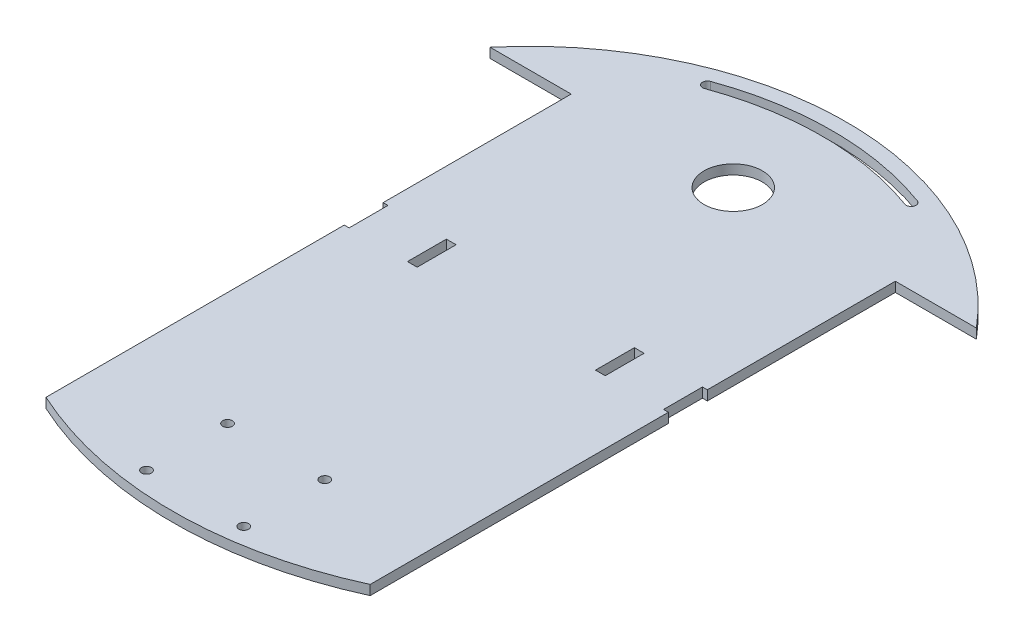
from build123d import *

# Parameters (mm, degrees)
SKETCH1_R           = 9
SKETCH1_W           = 3
SKETCH1_H           = 12
BOSS_EXTRUDE1_DEPTH = 3
SKETCH2_R           = 1.5
CUT_EXTRUDE1_DEPTH  = 139.166566144


with BuildPart() as part:
    # Sketch1 → Boss-Extrude1 (new body)
    with BuildSketch(Plane(origin=(0, 0, 0), x_dir=(1, 0, 0), z_dir=(0, 1, 0))):
        with BuildLine():
            Line((50, -81), (50, 11))
            Line((50, 11), (48.5, 11))
            Line((48.5, 11), (48.5, 23))
            Line((48.5, 23), (50, 23))
            Line((50, 23), (50, 81))
            Line((50, 81), (75, 81))
            ThreePointArc((75, 81), (0, 116), (-75, 81))
            Line((-75, 81), (-50, 81))
            Line((-50, 81), (-50, 23))
            Line((-50, 23), (-48.5, 23))
            Line((-48.5, 23), (-48.5, 11))
            Line((-48.5, 11), (-50, 11))
            Line((-50, 11), (-50, -81))
            ThreePointArc((-50, -81), (0, -91.912878854), (50, -81))
        make_face()
        with Locations(Location((0, 81, 0), (0, 0, 270))):
            Circle(SKETCH1_R, mode=Mode.SUBTRACT)
        with Locations((-29, 17)):
            Rectangle(SKETCH1_W, SKETCH1_H, mode=Mode.SUBTRACT)
        with Locations((29, 17)):
            Rectangle(SKETCH1_W, SKETCH1_H, mode=Mode.SUBTRACT)
        with BuildLine():
            ThreePointArc((31.93002338, 105.869875383), (0, 111.5), (-31.93002338, 105.869875383))
            ThreePointArc((-31.93002338, 105.869875383), (-32.826532097, 103.947306237), (-30.90396295, 103.050797521))
            ThreePointArc((-30.90396295, 103.050797521), (0, 108.5), (30.90396295, 103.050797521))
            ThreePointArc((30.90396295, 103.050797521), (32.826532097, 103.947306237), (31.93002338, 105.869875383))
        make_face(mode=Mode.SUBTRACT)
    extrude(amount=BOSS_EXTRUDE1_DEPTH)

    # Sketch2 → Cut-Extrude1 (cut, through all)
    with BuildSketch(Plane(origin=(0, 3, 0), x_dir=(1, 0, 0), z_dir=(0, 1, 0))):
        with Locations(Location((15, -60, 0), (0, 0, 270))):
            Circle(SKETCH2_R)
        with Locations(Location((15, -85, 0), (0, 0, 270))):
            Circle(SKETCH2_R)
        with Locations(Location((-15, -85, 0), (0, 0, 90))):
            Circle(SKETCH2_R)
        with Locations(Location((-15, -60, 0), (0, 0, 90))):
            Circle(SKETCH2_R)
    extrude(amount=-CUT_EXTRUDE1_DEPTH, mode=Mode.SUBTRACT)


solid = part.part
